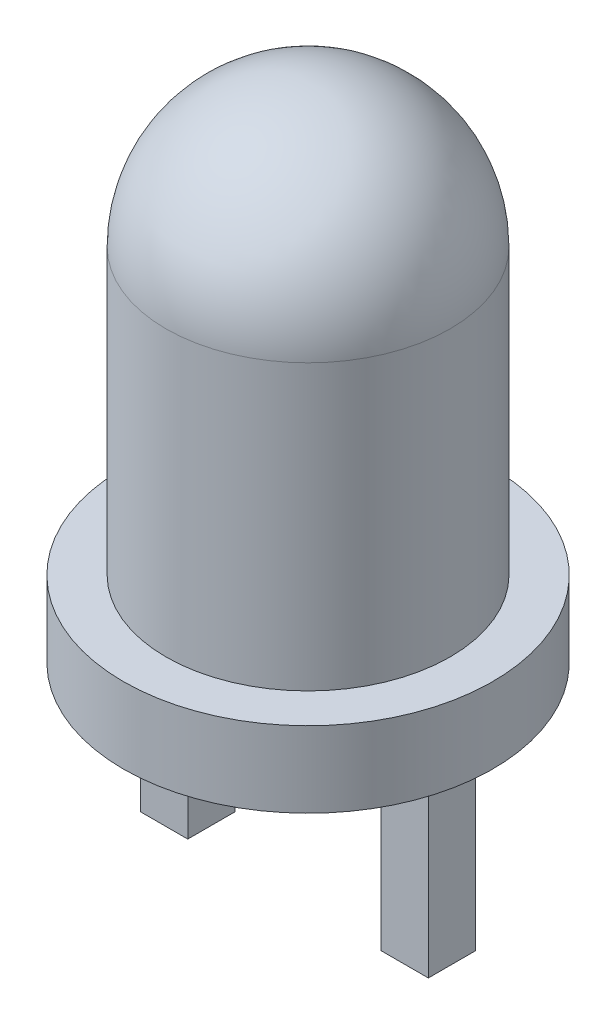
from build123d import *

# Parameters (mm, degrees)
SKETCH_1_W      = 1.95
SKETCH_1_H      = 0.8
SKETCH_2_W      = 0.5
SKETCH_2_H      = 0.5
EXTRUDE_1_DEPTH = 2


with BuildPart() as part:
    # Эскиз1 → Повернуть1 (revolve)
    with BuildSketch(Plane.XY, mode=Mode.PRIVATE) as revolve_1_sk:
        with BuildLine():
            Line((-1.5, 0.8), (0, 0.8))
            Line((0, 0.8), (0, 5.3))
            ThreePointArc((0, 5.3), (-1.060660172, 4.860660172), (-1.5, 3.8))
            Line((-1.5, 3.8), (-1.5, 0.8))
        make_face()
        with Locations((-0.975, 0.4)):
            Rectangle(SKETCH_1_W, SKETCH_1_H)
    revolve(revolve_1_sk.sketch.rotate(Axis((0, 8.783857323, 0), (0, -1, 0)), 270), axis=Axis((0, 8.783857323, 0), (0, -1, 0)))

    # Эскиз2 → Бобышка-Вытянуть1 (add)
    with BuildSketch(Plane.XZ):
        with Locations((-1.27, 0)):
            Rectangle(SKETCH_2_W, SKETCH_2_H)
        with Locations((1.27, 0)):
            Rectangle(SKETCH_2_W, SKETCH_2_H)
    extrude(amount=EXTRUDE_1_DEPTH)


solid = part.part
